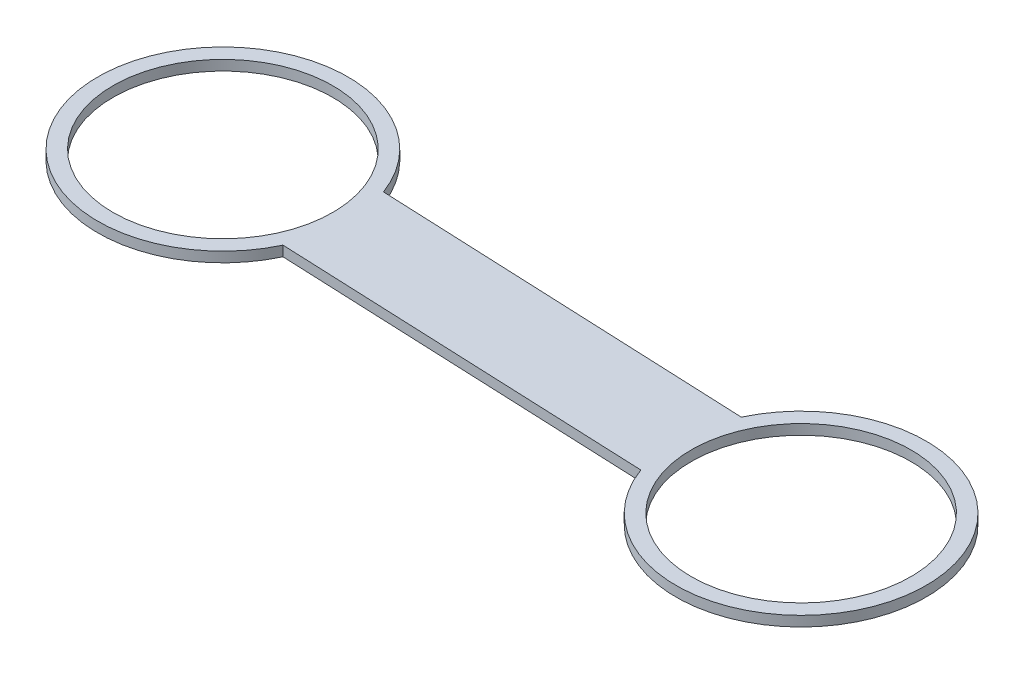
from build123d import *

# Parameters (mm, degrees)
SKETCH1_R           = 32.5
BOSS_EXTRUDE1_DEPTH = 3


with BuildPart() as part:
    # Sketch1 → Boss-Extrude1 (new body)
    with BuildSketch(Plane(origin=(0, 0, 0), x_dir=(1, 0, 0), z_dir=(0, 1, 0))):
        with BuildLine():
            Line((34.724455341, 12.775453074), (145.341023247, 8.00004525))
            ThreePointArc((145.341023247, 8.00004525), (215.771836356, -9.474231493), (144.033066178, -20.401199793))
            Line((144.033066178, -20.401199793), (33.495414057, -15.718054496))
            ThreePointArc((33.495414057, -15.718054496), (-36.965627799, 1.594478411), (34.724455341, 12.775453074))
        make_face()
        with Locations(Location((0, 0, 0), (0, 0, 270))):
            Circle(SKETCH1_R, mode=Mode.SUBTRACT)
        with Locations(Location((178.811009986, -7.772081673, 0), (0, 0, 270))):
            Circle(SKETCH1_R, mode=Mode.SUBTRACT)
    extrude(amount=BOSS_EXTRUDE1_DEPTH)


solid = part.part
